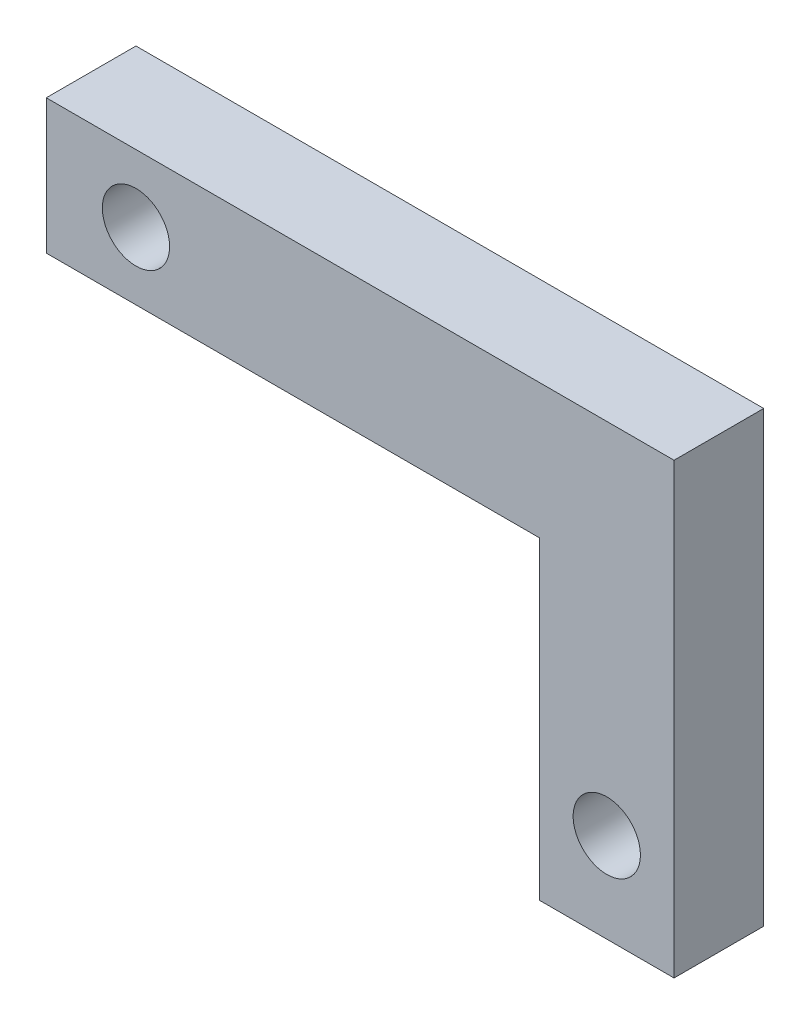
from build123d import *

# Parameters (mm, degrees)
SKETCH1_W           = 177.8
SKETCH1_H           = 38.1
SKETCH1_W_2         = 38.1
SKETCH1_H_2         = 88.9
BOSS_EXTRUDE1_DEPTH = 25.4
SKETCH2_R           = 9.525
CUT_EXTRUDE1_DEPTH  = 201.402619743
SKETCH3_R           = 9.525
CUT_EXTRUDE2_DEPTH  = 201.402619743


with BuildPart() as part:
    # Sketch1 → Boss-Extrude1 (new body)
    with BuildSketch(Plane.XY):
        with Locations((88.9, 19.05)):
            Rectangle(SKETCH1_W, SKETCH1_H)
        with Locations((158.75, -44.45)):
            Rectangle(SKETCH1_W_2, SKETCH1_H_2)
    extrude(amount=BOSS_EXTRUDE1_DEPTH)

    # Sketch2 → Cut-Extrude1 (cut, through all)
    with BuildSketch(Plane.XY.offset(25.4)):
        with Locations((25.4, 19.05)):
            Circle(SKETCH2_R)
    extrude(amount=-CUT_EXTRUDE1_DEPTH, mode=Mode.SUBTRACT)

    # Sketch3 → Cut-Extrude2 (cut, through all)
    with BuildSketch(Plane.XY.offset(25.4)):
        with Locations((158.75, -63.5)):
            Circle(SKETCH3_R)
    extrude(amount=-CUT_EXTRUDE2_DEPTH, mode=Mode.SUBTRACT)


solid = part.part
